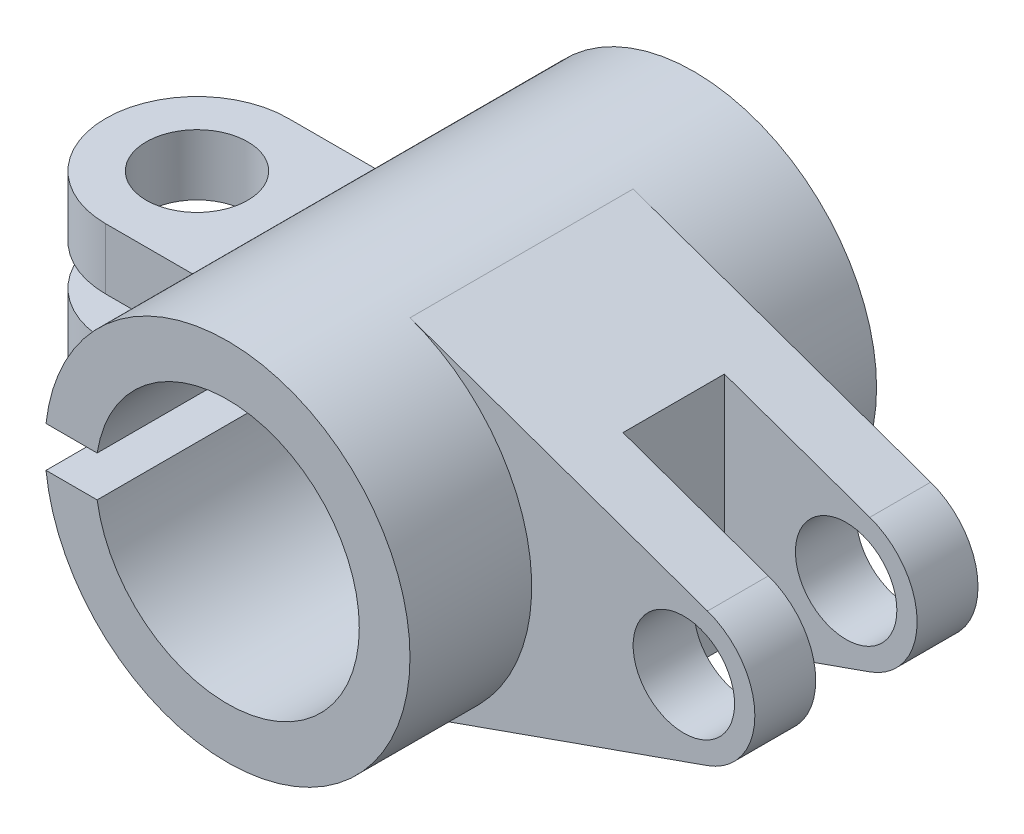
from build123d import *

# Parameters (mm, degrees)
BOSS_EXTRUDE1_DEPTH = 46
BOSS_EXTRUDE2_START = 12
SKETCH1_3_R         = 5
BOSS_EXTRUDE2_DEPTH = 6
BOSS_EXTRUDE3_START = 28
SKETCH1_4_R         = 5
BOSS_EXTRUDE3_DEPTH = 6
BOSS_EXTRUDE4_START = 14
BOSS_EXTRUDE4_DEPTH = 18
FILLET2_RADIUS      = 9
FILLET2_LENGTH      = 6
FILLET3_RADIUS      = 9
FILLET3_LENGTH      = 6
BOSS_EXTRUDE5_START = 12
BOSS_EXTRUDE5_DEPTH = 22


with BuildPart() as part:
    # Sketch1 → Boss-Extrude1 (new body)
    with BuildSketch(Plane.XY):
        with BuildLine():
            ThreePointArc((-12.845232579, -2), (13, 0), (-12.845232579, 2))
            Line((-12.845232579, 2), (-17.88854382, 2))
            ThreePointArc((-17.88854382, 2), (18, 0), (-17.88854382, -2))
            Line((-17.88854382, -2), (-12.845232579, -2))
        make_face()
    extrude(amount=BOSS_EXTRUDE1_DEPTH)

    # Sketch1<5> → Boss-Extrude4 (add)
    with BuildSketch(Plane.XY.offset(BOSS_EXTRUDE4_START)):
        with BuildLine():
            Line((-35, 2), (-17.88854382, 2))
            ThreePointArc((-17.88854382, 2), (-17.269106839, 5.077198931), (-16.124515497, 8))
            Line((-16.124515497, 8), (-35, 8))
            Line((-35, 8), (-35, 2))
        make_face()
        with BuildLine():
            ThreePointArc((-16.124515497, -8), (-17.269106839, -5.077198931), (-17.88854382, -2))
            Line((-17.88854382, -2), (-35, -2))
            Line((-35, -2), (-35, -8))
            Line((-35, -8), (-16.124515497, -8))
        make_face()
    extrude(amount=BOSS_EXTRUDE4_DEPTH)

    # Fillet2: full round fillet: the end face becomes a half cylinder, R = half its width
    fillet2_face = Plane((-35, 5, 23), x_dir=(0, 1, 0), z_dir=(-1, 0, 0))  # on the end face: x along it, z out of the body
    fillet2_slab = fillet2_face.offset(-FILLET2_RADIUS / 2) * Box(FILLET2_LENGTH, 2 * FILLET2_RADIUS, FILLET2_RADIUS, mode=Mode.PRIVATE)  # the body's end, R deep
    fillet2_round = Plane((-26, 5, 23), x_dir=(-1, 0, 0), z_dir=(0, 1, 0)) * Cylinder(FILLET2_RADIUS, FILLET2_LENGTH, mode=Mode.PRIVATE)  # its axis R under the face
    add(fillet2_slab - fillet2_round, mode=Mode.SUBTRACT)

    # Fillet3: full round fillet: the end face becomes a half cylinder, R = half its width
    fillet3_face = Plane((-35, -5, 23), x_dir=(0, -1, 0), z_dir=(-1, 0, 0))  # on the end face: x along it, z out of the body
    fillet3_slab = fillet3_face.offset(-FILLET3_RADIUS / 2) * Box(FILLET3_LENGTH, 2 * FILLET3_RADIUS, FILLET3_RADIUS, mode=Mode.PRIVATE)  # the body's end, R deep
    fillet3_round = Plane((-26, -5, 23), x_dir=(-1, 0, 0), z_dir=(0, -1, 0)) * Cylinder(FILLET3_RADIUS, FILLET3_LENGTH, mode=Mode.PRIVATE)  # its axis R under the face
    add(fillet3_slab - fillet3_round, mode=Mode.SUBTRACT)

    # Sketch2 → Ø10.0mm Dowel Hole1 (revolve, cut)
    with BuildSketch(Plane(origin=(-26, 8, 23), x_dir=(0, 0, 1), z_dir=(1, 0, 0))):
        Polygon((0, 0), (0, 33.004303095), (5, 30), (5, 0), align=None)
    revolve(axis=Axis((-26, 14.35, 23), (0, -1, 0)), mode=Mode.SUBTRACT)



with BuildPart() as body_2:
    # Sketch1<3> → Boss-Extrude2 (new body)
    with BuildSketch(Plane.XY.offset(BOSS_EXTRUDE2_START)):
        with BuildLine():
            Line((35.333333333, 6.599663291), (21, 11.66726189))
            Line((21, 11.66726189), (21, -11.66726189))
            Line((21, -11.66726189), (35.333333333, -6.599663291))
            ThreePointArc((35.333333333, -6.599663291), (40, 0), (35.333333333, 6.599663291))
        make_face()
        with Locations((33, 0)):
            Circle(SKETCH1_3_R, mode=Mode.SUBTRACT)
    extrude(amount=BOSS_EXTRUDE2_DEPTH)


with BuildPart() as body_3:
    # Sketch1<4> → Boss-Extrude3 (new body)
    with BuildSketch(Plane.XY.offset(BOSS_EXTRUDE3_START)):
        with BuildLine():
            Line((35.333333333, 6.599663291), (21, 11.66726189))
            Line((21, 11.66726189), (21, -11.66726189))
            Line((21, -11.66726189), (35.333333333, -6.599663291))
            ThreePointArc((35.333333333, -6.599663291), (40, 0), (35.333333333, 6.599663291))
        make_face()
        with Locations((33, 0)):
            Circle(SKETCH1_4_R, mode=Mode.SUBTRACT)
    extrude(amount=BOSS_EXTRUDE3_DEPTH)


with BuildPart() as part_1:
    add(part.part)

    add(body_2.part)  # Boss-Extrude5 merges body 2

    add(body_3.part)  # Boss-Extrude5 merges body 3
    # Sketch1<6> → Boss-Extrude5 (add)
    with BuildSketch(Plane.XY.offset(BOSS_EXTRUDE5_START)):
        with BuildLine():
            Line((21, 11.66726189), (6, 16.970562748))
            ThreePointArc((6, 16.970562748), (18, 0), (6, -16.970562748))
            Line((6, -16.970562748), (21, -11.66726189))
            Line((21, -11.66726189), (21, 11.66726189))
        make_face()
    extrude(amount=BOSS_EXTRUDE5_DEPTH)


solid = part_1.part
